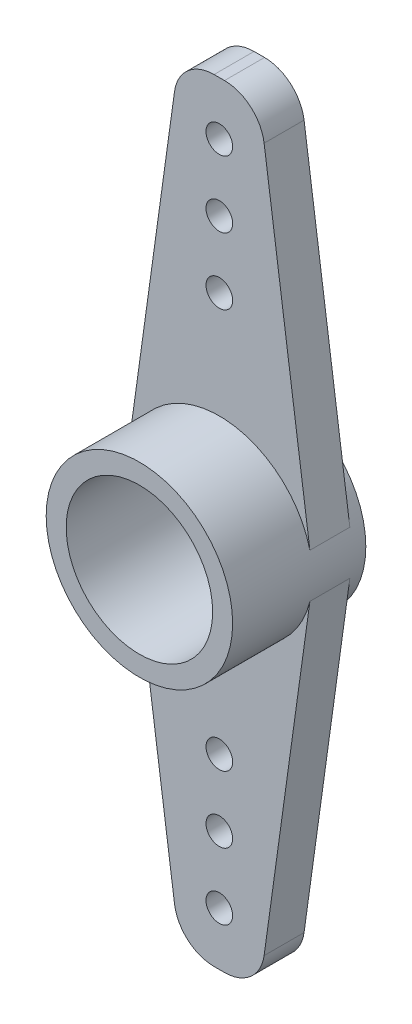
from build123d import *
from build123d.topology import SkipClean

# Parameters (mm, degrees)
SKETCH1_R           = 0.5
SKETCH1_R_2         = 1.5
BOSS_EXTRUDE3_DEPTH = 1.5
SKETCH2_R           = 3.5
BOSS_EXTRUDE4_DEPTH = 3
BOSS_EXTRUDE5_START = 0.5
SKETCH3_R           = 3.5
SKETCH3_R_2         = 3.25
BOSS_EXTRUDE5_DEPTH = 0.5
SKETCH4_R           = 2.75
CUT_EXTRUDE1_DEPTH  = 4


with BuildPart() as part:
    # Sketch1 → Boss-Extrude3 (new body)
    with BuildSketch(Plane.XY):
        with BuildLine():
            Line((-3.4, 0.830662386), (-1.681759988, 13.206282347))
            ThreePointArc((-1.681759988, 13.206282347), (-1.181043929, 14.131243458), (-0.196011829, 14.5))
            Line((-0.196011829, 14.5), (0.196011829, 14.5))
            ThreePointArc((0.196011829, 14.5), (1.181043929, 14.131243458), (1.681759988, 13.206282347))
            Line((1.681759988, 13.206282347), (3.4, 0.830662386))
            ThreePointArc((3.4, 0.830662386), (3.5, 0), (3.4, -0.830662386))
            Line((3.4, -0.830662386), (1.681759988, -13.206282347))
            ThreePointArc((1.681759988, -13.206282347), (1.181043929, -14.131243458), (0.196011829, -14.5))
            Line((0.196011829, -14.5), (-0.196011829, -14.5))
            ThreePointArc((-0.196011829, -14.5), (-1.181043929, -14.131243458), (-1.681759988, -13.206282347))
            Line((-1.681759988, -13.206282347), (-3.4, -0.830662386))
            ThreePointArc((-3.4, -0.830662386), (-3.5, 0), (-3.4, 0.830662386))
        make_face()
        with Locations((0, 10)):
            Circle(SKETCH1_R, mode=Mode.SUBTRACT)
        with Locations((0, 12.5)):
            Circle(SKETCH1_R, mode=Mode.SUBTRACT)
        with Locations((0, 7.5)):
            Circle(SKETCH1_R, mode=Mode.SUBTRACT)
        Circle(SKETCH1_R_2, mode=Mode.SUBTRACT)
        with Locations(Location((0, -7.5, 0), (0, 0, 180))):
            Circle(SKETCH1_R, mode=Mode.SUBTRACT)
        with Locations(Location((0, -12.5, 0), (0, 0, 180))):
            Circle(SKETCH1_R, mode=Mode.SUBTRACT)
        with Locations(Location((0, -10, 0), (0, 0, 180))):
            Circle(SKETCH1_R, mode=Mode.SUBTRACT)
    extrude(amount=BOSS_EXTRUDE3_DEPTH)

    # Sketch2 → Boss-Extrude4 (add)
    with SkipClean():  # the faces are left unmerged after this step: merging them gives an invalid solid
        with BuildSketch(Plane.XY.offset(1.5)):
            with Locations(Location((0, 0, 0), (0, 0, 166.270867325))):
                Circle(SKETCH2_R)
        extrude(amount=BOSS_EXTRUDE4_DEPTH)

    # Sketch3 → Boss-Extrude5 (add)
    with SkipClean():  # the faces are left unmerged after this step: merging them gives an invalid solid
        with BuildSketch(Plane(origin=(0, 0, 0), x_dir=(-1, 0, 0), z_dir=(0, 0, -1)).offset(BOSS_EXTRUDE5_START)):
            Circle(SKETCH3_R)
            Circle(SKETCH3_R_2, mode=Mode.SUBTRACT)
        extrude(amount=-BOSS_EXTRUDE5_DEPTH)

    # Sketch4 → Cut-Extrude1 (cut)
    with SkipClean():  # the faces are left unmerged after this step: merging them gives an invalid solid
        with BuildSketch(Plane.XY.offset(4.5)):
            Circle(SKETCH4_R)
        extrude(amount=-CUT_EXTRUDE1_DEPTH, mode=Mode.SUBTRACT)


solid = part.part
